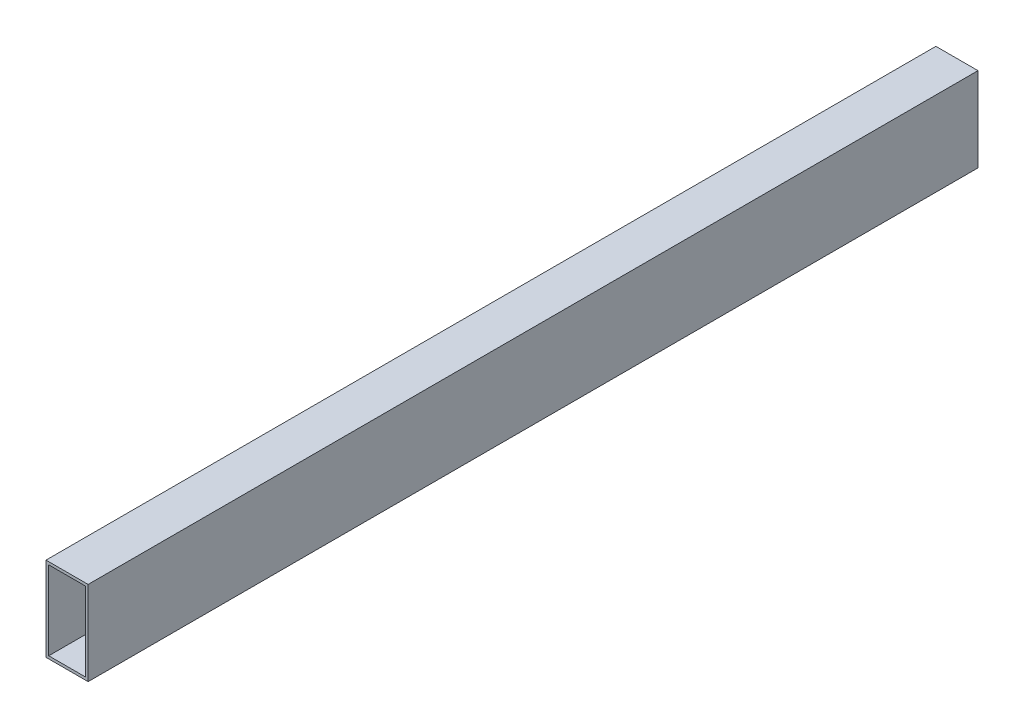
from build123d import *

# Parameters (mm, degrees)
SKETCH1_W           = 25.4
SKETCH1_H           = 50.8
BOSS_EXTRUDE1_DEPTH = 536.702
SKETCH2_W           = 22.098
SKETCH2_H           = 47.498
CUT_EXTRUDE1_DEPTH  = 540.728825368


with BuildPart() as part:
    # Sketch1 → Boss-Extrude1 (new body)
    with BuildSketch(Plane.XY):
        with Locations((-35.737209302, -4.799418605)):
            Rectangle(SKETCH1_W, SKETCH1_H)
    extrude(amount=BOSS_EXTRUDE1_DEPTH)

    # Sketch2 → Cut-Extrude1 (cut, through all)
    with BuildSketch(Plane.XY.offset(536.702)):
        with Locations((-35.737209302, -4.799418605)):
            Rectangle(SKETCH2_W, SKETCH2_H)
    extrude(amount=-CUT_EXTRUDE1_DEPTH, mode=Mode.SUBTRACT)


solid = part.part
